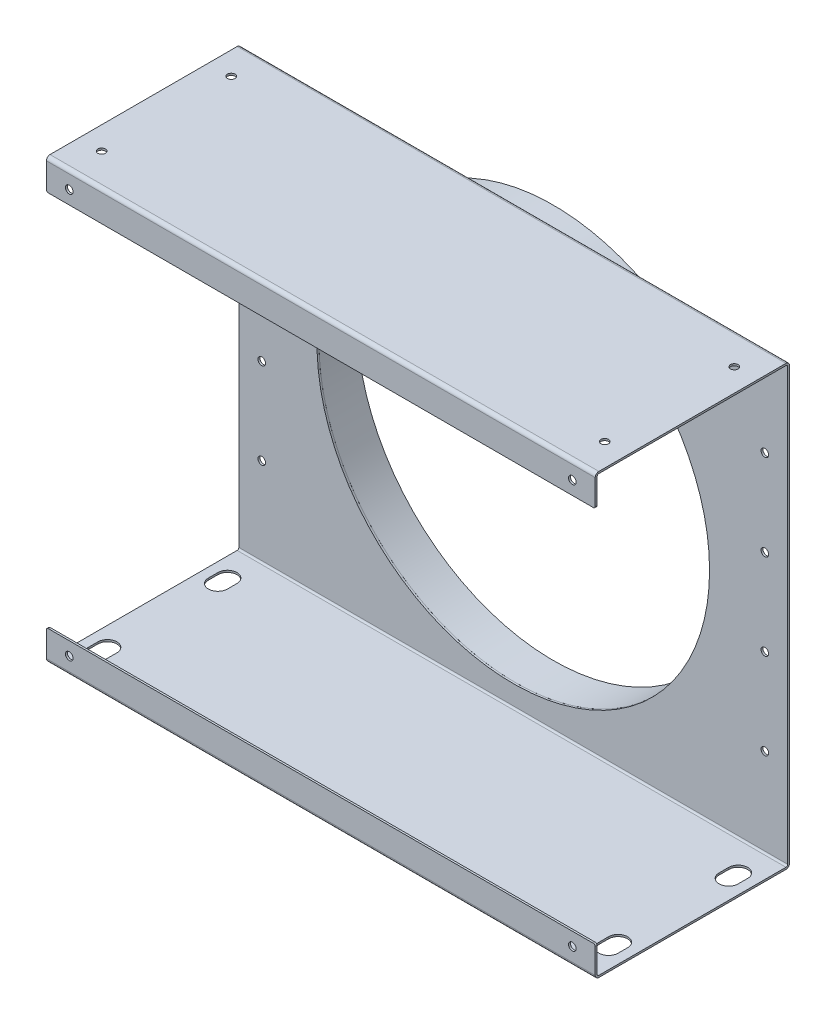
from build123d import *

# Parameters (mm, degrees)
SKETCH_1_W          = 288
SKETCH_1_H          = 230
SKETCH_1_R          = 103
EXTRUDE_1_DEPTH     = 1
SKETCH_2_W          = 288
SKETCH_2_H          = 1
EXTRUDE_2_DEPTH     = 101
FILLET_1_R          = 1.9
FILLET_2_R          = 0.9
SKETCH_3_W          = 288
SKETCH_3_H          = 1
EXTRUDE_3_DEPTH     = 15
SKETCH_4_W          = 288
SKETCH_4_H          = 1
EXTRUDE_4_DEPTH     = 15
FILLET_3_R          = 1.9
FILLET_4_R          = 0.9
SKETCH_5_R          = 104
SKETCH_5_R_2        = 103
EXTRUDE_5_DEPTH     = 20
FILLET_10_R         = 1
SKETCH_7_R          = 2
CUT_EXTRUDE_1_DEPTH = 30
SKETCH_8_R          = 2
CUT_EXTRUDE_2_DEPTH = 30
SKETCH_9_R          = 2
CUT_EXTRUDE_3_DEPTH = 30
SKETCH_10_R         = 2
CUT_EXTRUDE_4_DEPTH = 30
CUT_EXTRUDE_5_DEPTH = 10


with BuildPart() as part:
    # Эскиз1 → Бобышка-Вытянуть1 (new body)
    with BuildSketch(Plane.XY):
        with Locations((144, 115)):
            Rectangle(SKETCH_1_W, SKETCH_1_H)
        with Locations((144, 115)):
            Circle(SKETCH_1_R, mode=Mode.SUBTRACT)
    extrude(amount=EXTRUDE_1_DEPTH)

    # Эскиз2 → Бобышка-Вытянуть2 (add)
    with BuildSketch(Plane.XY.offset(1)):
        with Locations((144, 229.5)):
            Rectangle(SKETCH_2_W, SKETCH_2_H)
        with Locations((144, 0.5)):
            Rectangle(SKETCH_2_W, SKETCH_2_H)
    extrude(amount=EXTRUDE_2_DEPTH)

    # Скругление1
    fillet_1_edges = [part.edges().sort_by_distance(p)[0] for p in [
        (144, 0, 0),
        (144, 230, 0),
    ]]
    fillet(fillet_1_edges, radius=FILLET_1_R)

    # Скругление2
    fillet_2_edges = [part.edges().sort_by_distance(p)[0] for p in [
        (144, 229, 1),
        (144, 1, 1),
    ]]
    fillet(fillet_2_edges, radius=FILLET_2_R)

    # Эскиз3 → Бобышка-Вытянуть3 (add)
    with BuildSketch(Plane.XZ.offset(-229)):
        with Locations((144, 101.5)):
            Rectangle(SKETCH_3_W, SKETCH_3_H)
    extrude(amount=EXTRUDE_3_DEPTH)

    # Эскиз4 → Бобышка-Вытянуть4 (add)
    with BuildSketch(Plane(origin=(0, 1, 0), x_dir=(1, 0, 0), z_dir=(0, 1, 0))):
        with Locations((144, -101.5)):
            Rectangle(SKETCH_4_W, SKETCH_4_H)
    extrude(amount=EXTRUDE_4_DEPTH)

    # Скругление3
    fillet_3_edges = [part.edges().sort_by_distance(p)[0] for p in [
        (144, 230, 102),
        (144, 0, 102),
    ]]
    fillet(fillet_3_edges, radius=FILLET_3_R)

    # Скругление4
    fillet_4_edges = [part.edges().sort_by_distance(p)[0] for p in [
        (144, 229, 101),
        (144, 1, 101),
    ]]
    fillet(fillet_4_edges, radius=FILLET_4_R)

    # Скругление10
    fillet_10_edges = [part.edges().sort_by_distance(p)[0] for p in [
        (0, 214, 101.5),
        (288, 214, 101.5),
        (0, 16, 101.5),
        (288, 16, 101.5),
    ]]
    fillet(fillet_10_edges, radius=FILLET_10_R)

    # Эскиз7 → Вырез-Вытянуть1 (cut)
    with BuildSketch(Plane(origin=(0, 230, 0), x_dir=(1, 0, 0), z_dir=(0, 1, 0))):
        with Locations(Location((12, -17, 0), (0, 0, 270))):
            Circle(SKETCH_7_R)
        with Locations(Location((12, -85, 0), (0, 0, 270))):
            Circle(SKETCH_7_R)
        with Locations(Location((276, -85, 0), (0, 0, 270))):
            Circle(SKETCH_7_R)
        with Locations(Location((276, -17, 0), (0, 0, 270))):
            Circle(SKETCH_7_R)
    extrude(amount=-CUT_EXTRUDE_1_DEPTH, mode=Mode.SUBTRACT)

    # Эскиз8 → Вырез-Вытянуть2 (cut)
    with BuildSketch(Plane.XY.offset(102)):
        with Locations((12, 221)):
            Circle(SKETCH_8_R)
        with Locations((276, 221)):
            Circle(SKETCH_8_R)
    extrude(amount=-CUT_EXTRUDE_2_DEPTH, mode=Mode.SUBTRACT)

    # Эскиз9 → Вырез-Вытянуть3 (cut)
    with BuildSketch(Plane.XY.offset(102)):
        with Locations((12, 9)):
            Circle(SKETCH_9_R)
        with Locations((276, 9)):
            Circle(SKETCH_9_R)
    extrude(amount=-CUT_EXTRUDE_3_DEPTH, mode=Mode.SUBTRACT)

    # Эскиз10 → Вырез-Вытянуть4 (cut)
    with BuildSketch(Plane(origin=(0, 0, 0), x_dir=(-1, 0, 0), z_dir=(0, 0, -1))):
        with Locations((-12, 182.9)):
            Circle(SKETCH_10_R)
        with Locations((-12, 137.7)):
            Circle(SKETCH_10_R)
        with Locations((-12, 47.3)):
            Circle(SKETCH_10_R)
        with Locations((-12, 92.5)):
            Circle(SKETCH_10_R)
        with Locations((-276, 92.5)):
            Circle(SKETCH_10_R)
        with Locations((-276, 47.3)):
            Circle(SKETCH_10_R)
        with Locations((-276, 137.7)):
            Circle(SKETCH_10_R)
        with Locations((-276, 182.9)):
            Circle(SKETCH_10_R)
    extrude(amount=-CUT_EXTRUDE_4_DEPTH, mode=Mode.SUBTRACT)

    # Эскиз11 → Вырез-Вытянуть5 (cut)
    with BuildSketch(Plane(origin=(0, 1, 0), x_dir=(1, 0, 0), z_dir=(0, 1, 0))):
        with BuildLine():
            Line((5, -17), (5, -22))
            ThreePointArc((5, -22), (10, -27), (15, -22))
            Line((15, -22), (15, -17))
            ThreePointArc((15, -17), (10, -12), (5, -17))
        make_face()
        with BuildLine():
            Line((5, -85), (5, -80))
            ThreePointArc((5, -80), (10, -75), (15, -80))
            Line((15, -80), (15, -85))
            ThreePointArc((15, -85), (10, -90), (5, -85))
        make_face()
        with BuildLine():
            Line((283, -22), (283, -17))
            ThreePointArc((283, -17), (278, -12), (273, -17))
            Line((273, -17), (273, -22))
            ThreePointArc((273, -22), (278, -27), (283, -22))
        make_face()
        with BuildLine():
            Line((283, -85), (283, -80))
            ThreePointArc((283, -80), (278, -75), (273, -80))
            Line((273, -80), (273, -85))
            ThreePointArc((273, -85), (278, -90), (283, -85))
        make_face()
    extrude(amount=-CUT_EXTRUDE_5_DEPTH, mode=Mode.SUBTRACT)


with BuildPart() as body_2:
    # Эскиз5 → Бобышка-Вытянуть5 (new body)
    with BuildSketch(Plane(origin=(0, 0, 0), x_dir=(-1, 0, 0), z_dir=(0, 0, -1))):
        with Locations((-144, 115)):
            Circle(SKETCH_5_R)
        with Locations((-144, 115)):
            Circle(SKETCH_5_R_2, mode=Mode.SUBTRACT)
    extrude(amount=EXTRUDE_5_DEPTH)


solid = Compound([part.part, body_2.part])
